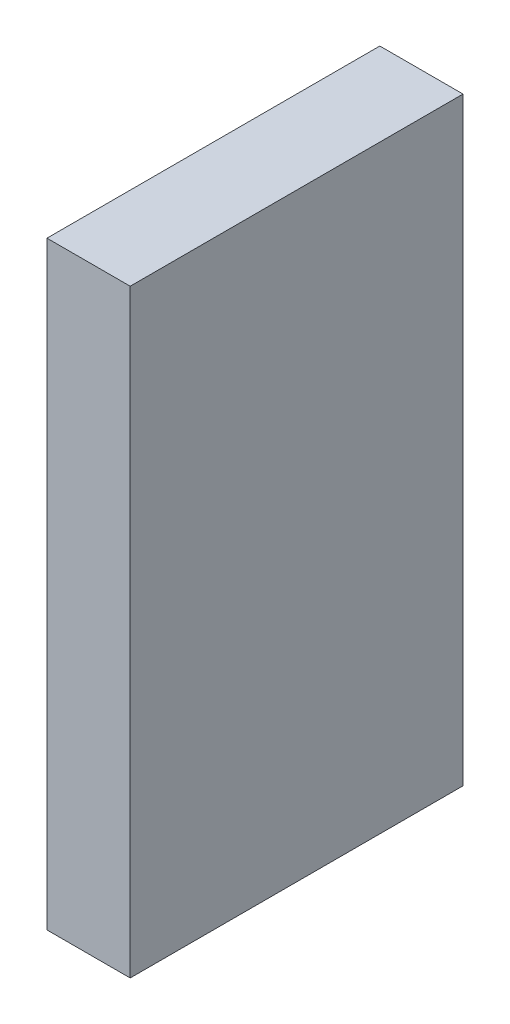
from build123d import *

# Parameters (mm, degrees)
SKETCH1_W           = 2.5
SKETCH1_H           = 10
BOSS_EXTRUDE1_DEPTH = 18


with BuildPart() as part:
    # Sketch1 → Boss-Extrude1 (new body)
    with BuildSketch(Plane(origin=(0, 0, 0), x_dir=(1, 0, 0), z_dir=(0, 1, 0))):
        Rectangle(SKETCH1_W, SKETCH1_H)
    extrude(amount=BOSS_EXTRUDE1_DEPTH)


solid = part.part
